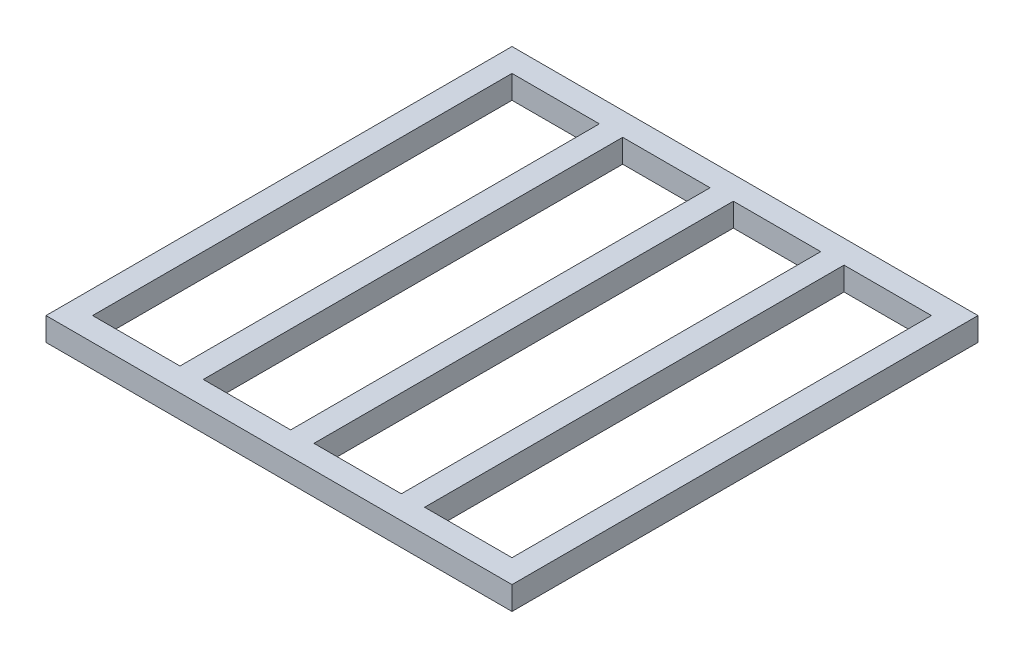
from build123d import *

# Parameters (mm, degrees)
SKETCH3_W           = 40
SKETCH3_H           = 40
SKETCH3_W_2         = 7.5
SKETCH3_H_2         = 36
BOSS_EXTRUDE2_DEPTH = 2


with BuildPart() as part:
    # Sketch3 → Boss-Extrude2 (new body)
    with BuildSketch(Plane(origin=(0, 0, 0), x_dir=(1, 0, 0), z_dir=(0, 1, 0))):
        with Locations((-20, 20)):
            Rectangle(SKETCH3_W, SKETCH3_H)
        with Locations((-24.75, 20)):
            Rectangle(SKETCH3_W_2, SKETCH3_H_2, mode=Mode.SUBTRACT)
        with Locations((-34.25, 20)):
            Rectangle(SKETCH3_W_2, SKETCH3_H_2, mode=Mode.SUBTRACT)
        with Locations((-15.25, 20)):
            Rectangle(SKETCH3_W_2, SKETCH3_H_2, mode=Mode.SUBTRACT)
        with Locations((-5.75, 20)):
            Rectangle(SKETCH3_W_2, SKETCH3_H_2, mode=Mode.SUBTRACT)
    extrude(amount=BOSS_EXTRUDE2_DEPTH)


solid = part.part
